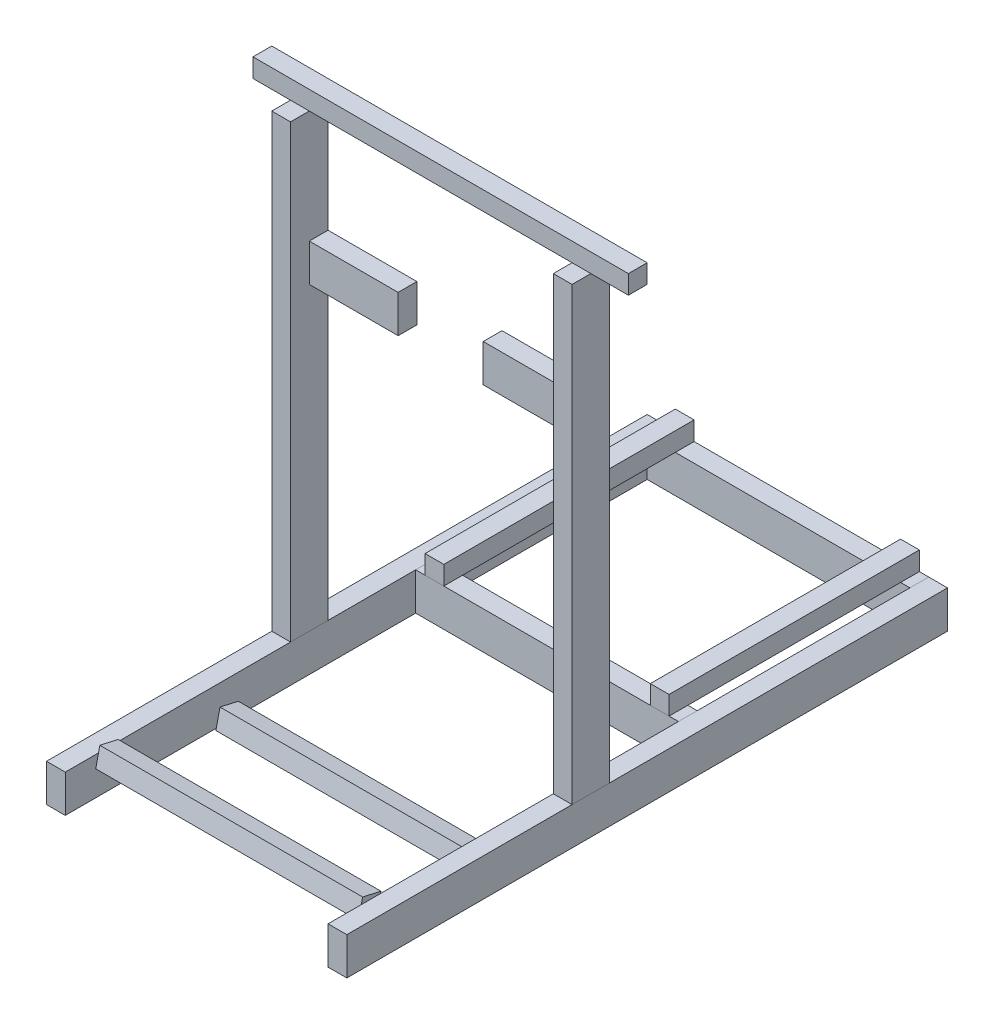
from build123d import *

# Parameters (mm, degrees)
SKETCH1_W                  = 38.1
SKETCH1_H                  = 76.2
BOSS_EXTRUDE1_DEPTH        = 1219.2
BOSS_EXTRUDE1_2_DEPTH      = 1219.2
BOSS_EXTRUDE2_DEPTH        = 266.7
BOSS_EXTRUDE2_DEPTH_BACK   = 266.7
SKETCH2_W                  = 38.1
SKETCH2_H                  = 76.2
BOSS_EXTRUDE2_2_DEPTH      = 266.7
BOSS_EXTRUDE2_2_DEPTH_BACK = 266.7
SKETCH3_W                  = 38.1
SKETCH3_H                  = 76.2
BOSS_EXTRUDE3_DEPTH        = 914.4
BOSS_EXTRUDE3_2_DEPTH      = 914.4
SKETCH4_W                  = 38.1
SKETCH4_H                  = 38.1
BOSS_EXTRUDE4_DEPTH        = 508
BOSS_EXTRUDE4_2_DEPTH      = 508
BOSS_EXTRUDE5_DEPTH        = 266.7
BOSS_EXTRUDE5_DEPTH_BACK   = 266.7
BOSS_EXTRUDE5_2_DEPTH      = 266.7
BOSS_EXTRUDE5_2_DEPTH_BACK = 266.7
BOSS_EXTRUDE6_DEPTH        = 266.7
BOSS_EXTRUDE6_DEPTH_BACK   = 266.7
SKETCH7_W                  = 38.1
SKETCH7_H                  = 76.2
SKETCH7_2_W                = 38.1
SKETCH7_2_H                = 76.2
CUT_EXTRUDE1_DEPTH         = 86.35000002
SKETCH8_W                  = 38.1
SKETCH8_H                  = 38.1
BOSS_EXTRUDE7_DEPTH        = 381


with BuildPart() as part:
    # Sketch1 → Boss-Extrude1 (new body)
    with BuildSketch(Plane.XY):
        with Locations((-285.75, 57.15)):
            Rectangle(SKETCH1_W, SKETCH1_H)
    extrude(amount=-BOSS_EXTRUDE1_DEPTH)


with BuildPart() as body_2:
    # Sketch1 → Boss-Extrude1 2 (new body)
    with BuildSketch(Plane.XY):
        with Locations((285.75, 57.15)):
            Rectangle(SKETCH1_W, SKETCH1_H)
    extrude(amount=-BOSS_EXTRUDE1_2_DEPTH)


with BuildPart() as body_3:
    # Sketch2 → Boss-Extrude2 (new, two sides: drawn at the far end of the back side and taken through both)
    with BuildSketch(Plane(origin=(0, 0, 0), x_dir=(0, 0, -1), z_dir=(1, 0, 0)).offset(-BOSS_EXTRUDE2_DEPTH_BACK)):
        with Locations((1200.15, 57.15)):
            Rectangle(SKETCH2_W, SKETCH2_H)
    extrude(amount=BOSS_EXTRUDE2_DEPTH + BOSS_EXTRUDE2_DEPTH_BACK)


with BuildPart() as body_4:
    # Sketch2 → Boss-Extrude2 2 (new, two sides: drawn at the far end of the back side and taken through both)
    with BuildSketch(Plane(origin=(0, 0, 0), x_dir=(0, 0, -1), z_dir=(1, 0, 0)).offset(-BOSS_EXTRUDE2_2_DEPTH_BACK)):
        with Locations((730.25, 57.15)):
            Rectangle(SKETCH2_W, SKETCH2_H)
    extrude(amount=BOSS_EXTRUDE2_2_DEPTH + BOSS_EXTRUDE2_2_DEPTH_BACK)


with BuildPart() as body_5:
    # Sketch3 → Boss-Extrude3 (new body)
    with BuildSketch(Plane(origin=(0, 95.25, 0), x_dir=(1, 0, 0), z_dir=(0, 1, 0))):
        with Locations((-285.75, 495.3)):
            Rectangle(SKETCH3_W, SKETCH3_H)
    extrude(amount=BOSS_EXTRUDE3_DEPTH)


with BuildPart() as body_6:
    # Sketch3 → Boss-Extrude3 2 (new body)
    with BuildSketch(Plane(origin=(0, 95.25, 0), x_dir=(1, 0, 0), z_dir=(0, 1, 0))):
        with Locations((285.75, 495.3)):
            Rectangle(SKETCH3_W, SKETCH3_H)
    extrude(amount=BOSS_EXTRUDE3_2_DEPTH)


with BuildPart() as body_7:
    # Sketch4 → Boss-Extrude4 (new body)
    with BuildSketch(Plane.XY.offset(-711.2)):
        with Locations((-228.6, 114.3)):
            Rectangle(SKETCH4_W, SKETCH4_H)
    extrude(amount=-BOSS_EXTRUDE4_DEPTH)


with BuildPart() as body_8:
    # Sketch4 → Boss-Extrude4 2 (new body)
    with BuildSketch(Plane.XY.offset(-711.2)):
        with Locations((228.6, 114.3)):
            Rectangle(SKETCH4_W, SKETCH4_H)
    extrude(amount=-BOSS_EXTRUDE4_2_DEPTH)


with BuildPart() as body_9:
    # Sketch6 → Boss-Extrude5 (new, two sides: drawn at the far end of the back side and taken through both)
    with BuildSketch(Plane(origin=(0, 0, 0), x_dir=(0, 0, -1), z_dir=(1, 0, 0)).offset(-BOSS_EXTRUDE5_DEPTH_BACK)):
        Polygon((61.789465074, 70.141651495), (70.141651495, 107.314907769), (107.314907769, 98.962721347), (98.962721347, 61.789465074), align=None)
    extrude(amount=BOSS_EXTRUDE5_DEPTH + BOSS_EXTRUDE5_DEPTH_BACK)


with BuildPart() as body_10:
    # Sketch6 → Boss-Extrude5 2 (new, two sides: drawn at the far end of the back side and taken through both)
    with BuildSketch(Plane(origin=(0, 0, 0), x_dir=(0, 0, -1), z_dir=(1, 0, 0)).offset(-BOSS_EXTRUDE5_2_DEPTH_BACK)):
        Polygon((305.708469494, 15.337278653), (314.060655915, 52.510534926), (351.233912189, 44.158348505), (342.881725768, 6.985092231), align=None)
    extrude(amount=BOSS_EXTRUDE5_2_DEPTH + BOSS_EXTRUDE5_2_DEPTH_BACK)


with BuildPart() as body_11:
    # Sketch7 → Boss-Extrude6 (new, two sides: drawn at the far end of the back side and taken through both)
    with BuildSketch(Plane(origin=(0, 0, 0), x_dir=(0, 0, -1), z_dir=(1, 0, 0)).offset(-BOSS_EXTRUDE6_DEPTH_BACK)):
        with Locations((514.35, 742.95)):
            Rectangle(SKETCH7_W, SKETCH7_H)
    extrude(amount=BOSS_EXTRUDE6_DEPTH + BOSS_EXTRUDE6_DEPTH_BACK)

    # Sketch7<2> → Cut-Extrude1 (cut, symmetric)
    with BuildSketch(Plane(origin=(0, 0, 0), x_dir=(0, 0, -1), z_dir=(1, 0, 0))):
        with Locations((514.35, 742.95)):
            Rectangle(SKETCH7_2_W, SKETCH7_2_H)
    extrude(amount=CUT_EXTRUDE1_DEPTH, both=True, mode=Mode.SUBTRACT)


with BuildPart() as cut_extrude1_piece_1:
    # of the separate pieces the step leaves, piece 1, a body of its own (cut_extrude1_pieces)
    add(body_11.part.solids().sort_by_distance((266.7, 781.05, -533.4))[0])


with BuildPart() as cut_extrude1_piece_2:
    # of the separate pieces the step leaves, piece 2, a body of its own (cut_extrude1_pieces)
    add(body_11.part.solids().sort_by_distance((-86.35000002, 781.05, -533.4))[0])


with BuildPart() as body_13:
    # Sketch8 → Boss-Extrude7 (new, symmetric)
    with BuildSketch(Plane(origin=(0, 0, 0), x_dir=(0, 0, -1), z_dir=(1, 0, 0))):
        with Locations((514.35, 1028.7)):
            Rectangle(SKETCH8_W, SKETCH8_H)
    extrude(amount=BOSS_EXTRUDE7_DEPTH, both=True)


solid = Compound([part.part, body_2.part, body_3.part, body_4.part, body_5.part, body_6.part, body_7.part, body_8.part, body_9.part, body_10.part, cut_extrude1_piece_1.part, cut_extrude1_piece_2.part, body_13.part])
